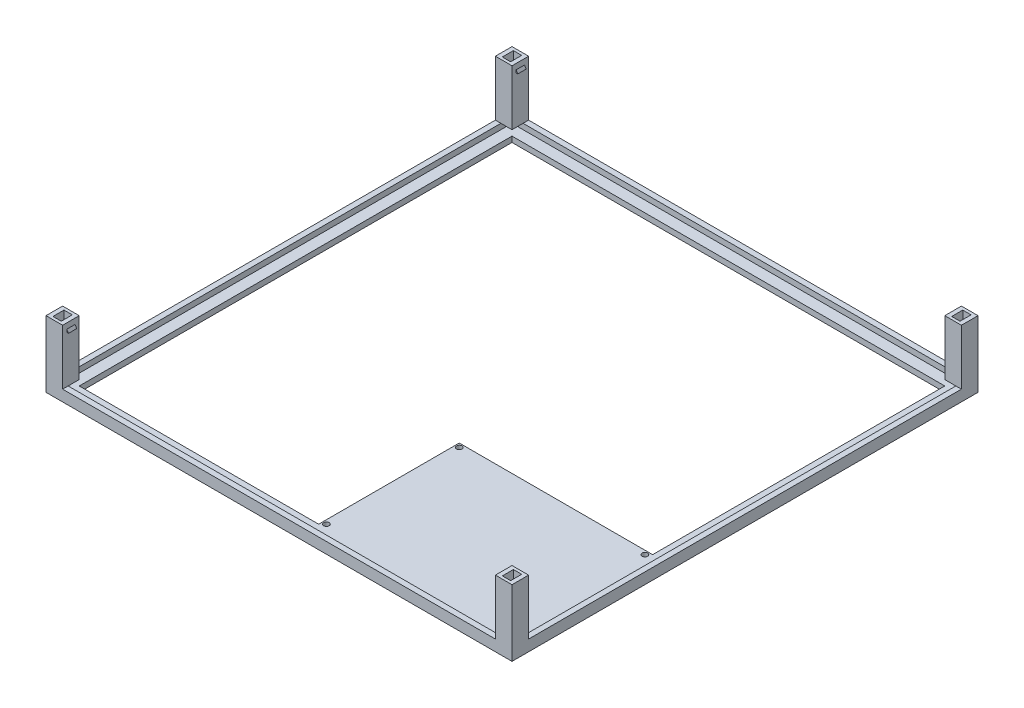
from build123d import *

# Parameters (mm, degrees)
SKETCH1_W            = 164.3375
SKETCH1_H            = 164.3375
SKETCH1_R            = 1
BOSS_EXTRUDE1_DEPTH  = 2
SKETCH1_3_W          = 168.3375
SKETCH1_3_H          = 168.3375
SKETCH1_3_W_2        = 164.3375
SKETCH1_3_H_2        = 164.3375
BOSS_EXTRUDE2_DEPTH  = 4
SKETCH2_W            = 6
SKETCH2_H            = 6
BOSS_EXTRUDE3_DEPTH  = 20
SKETCH3_W            = 3
SKETCH3_H            = 4
CUT_EXTRUDE1_DEPTH   = 4
BOSS_EXTRUDE4_START  = -1.5
BOSS_EXTRUDE4_DEPTH  = 3
MIRROR2_START        = -1.5
MIRROR2_COPY_1_DEPTH = 3
MIRROR2_COPY_2_DEPTH = 3


with BuildPart() as part:
    # Sketch1 → Boss-Extrude1 (new body)
    with BuildSketch(Plane(origin=(0, 0, 0), x_dir=(1, 0, 0), z_dir=(0, 1, 0))):
        Rectangle(SKETCH1_W, SKETCH1_H)
        Polygon((8.31875, -27.36875), (8.31875, -78.16875), (-78.16875, -78.16875), (-78.16875, 78.16875), (78.16875, 78.16875), (78.16875, -27.36875), (9.71875, -27.36875), align=None, mode=Mode.SUBTRACT)
        with Locations((9.71875, -76.76875)):
            Circle(SKETCH1_R, mode=Mode.SUBTRACT)
        with Locations((76.76875, -76.76875)):
            Circle(SKETCH1_R, mode=Mode.SUBTRACT)
        with Locations((9.71875, -28.76875)):
            Circle(SKETCH1_R, mode=Mode.SUBTRACT)
        with Locations((76.76875, -28.76875)):
            Circle(SKETCH1_R, mode=Mode.SUBTRACT)
    extrude(amount=BOSS_EXTRUDE1_DEPTH)

    # Sketch1<3> → Boss-Extrude2 (add)
    with BuildSketch(Plane(origin=(0, 0, 0), x_dir=(1, 0, 0), z_dir=(0, 1, 0))):
        Rectangle(SKETCH1_3_W, SKETCH1_3_H)
        Rectangle(SKETCH1_3_W_2, SKETCH1_3_H_2, mode=Mode.SUBTRACT)
    extrude(amount=BOSS_EXTRUDE2_DEPTH)

    # Sketch2 → Boss-Extrude3 (add)
    with BuildSketch(Plane(origin=(0, 4, 0), x_dir=(1, 0, 0), z_dir=(0, 1, 0))):
        with Locations((-81.16875, 81.16875)):
            Rectangle(SKETCH2_W, SKETCH2_H)
        with Locations((81.16875, 81.16875)):
            Rectangle(SKETCH2_W, SKETCH2_H)
        with Locations((81.16875, -81.16875)):
            Rectangle(SKETCH2_W, SKETCH2_H)
        with Locations((-81.16875, -81.16875)):
            Rectangle(SKETCH2_W, SKETCH2_H)
    extrude(amount=BOSS_EXTRUDE3_DEPTH)

    # Sketch3 → Cut-Extrude1 (cut)
    with BuildSketch(Plane(origin=(0, 24, 0), x_dir=(1, 0, 0), z_dir=(0, 1, 0))):
        with Locations((81.16875, -81.16875)):
            Rectangle(SKETCH3_W, SKETCH3_H)
        with Locations((81.16875, 81.16875)):
            Rectangle(SKETCH3_W, SKETCH3_H)
        with Locations((-81.16875, 81.16875)):
            Rectangle(SKETCH3_W, SKETCH3_H)
        with Locations((-81.16875, -81.16875)):
            Rectangle(SKETCH3_W, SKETCH3_H)
    extrude(amount=-CUT_EXTRUDE1_DEPTH, mode=Mode.SUBTRACT)

    # Sketch4 → Boss-Extrude4 (add)
    with BuildSketch(Plane(origin=(0, 0, 78.16875), x_dir=(-1, 0, 0), z_dir=(0, 0, -1)).offset(BOSS_EXTRUDE4_START)):
        Polygon((-77.56875, 21), (-78.16875, 22), (-78.16875, 21), align=None)
    boss_extrude4 = extrude(amount=-BOSS_EXTRUDE4_DEPTH)

    # Mirror1: Boss-Extrude4 across plane
    add(boss_extrude4.mirror(Plane(origin=(0, 0, 0), x_dir=(0, 0, 1), z_dir=(1, 0, 0))))

    # Mirror2 copy 1 sketch → Mirror2 copy 1 (add)
    with BuildSketch(Plane.XY.offset(-78.16875).offset(MIRROR2_START)):
        Polygon((-77.56875, 21), (-78.16875, 22), (-78.16875, 21), align=None)
    extrude(amount=-MIRROR2_COPY_1_DEPTH)

    # Mirror2 copy 2 sketch → Mirror2 copy 2 (add)
    with BuildSketch(Plane(origin=(0, 0, -78.16875), x_dir=(-1, 0, 0), z_dir=(0, 0, 1)).offset(MIRROR2_START)):
        Polygon((-77.56875, -21), (-78.16875, -22), (-78.16875, -21), align=None)
    extrude(amount=-MIRROR2_COPY_2_DEPTH)


solid = part.part
